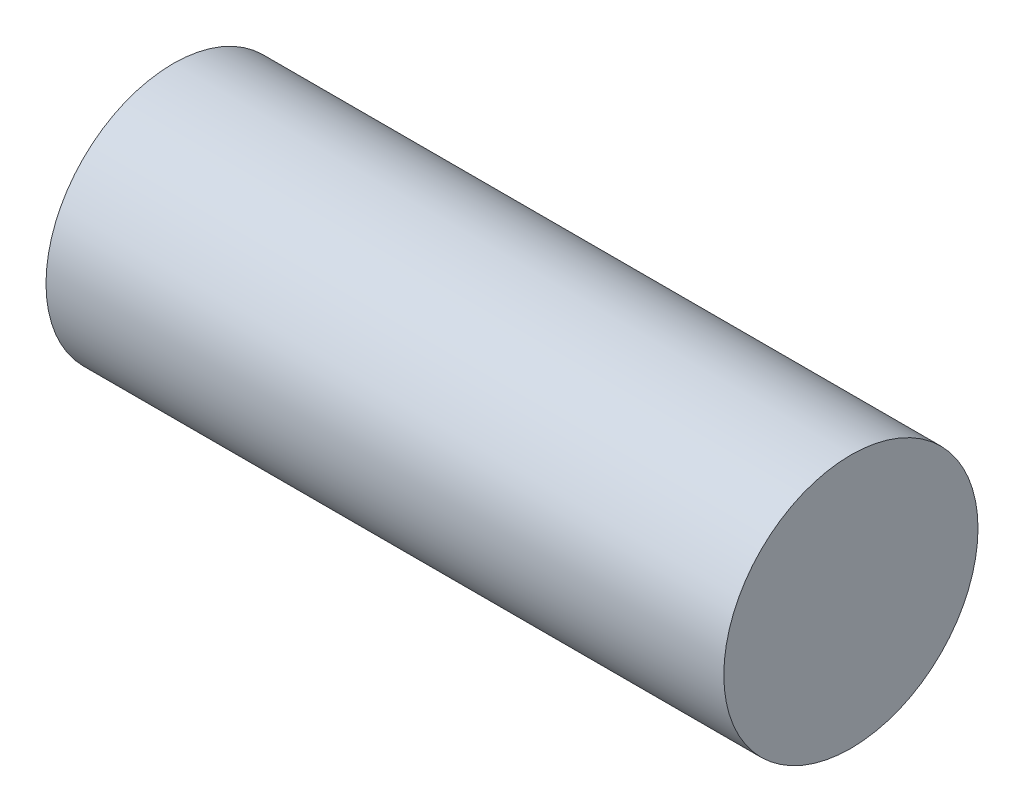
from build123d import *

# Parameters (mm, degrees)
SKETCH1_R           = 0.75
BOSS_EXTRUDE1_DEPTH = 4


with BuildPart() as part:
    # Sketch1 → Boss-Extrude1 (new body)
    with BuildSketch(Plane(origin=(0, 0, 0), x_dir=(0, 0, -1), z_dir=(1, 0, 0))):
        Circle(SKETCH1_R)
    extrude(amount=BOSS_EXTRUDE1_DEPTH)


solid = part.part
